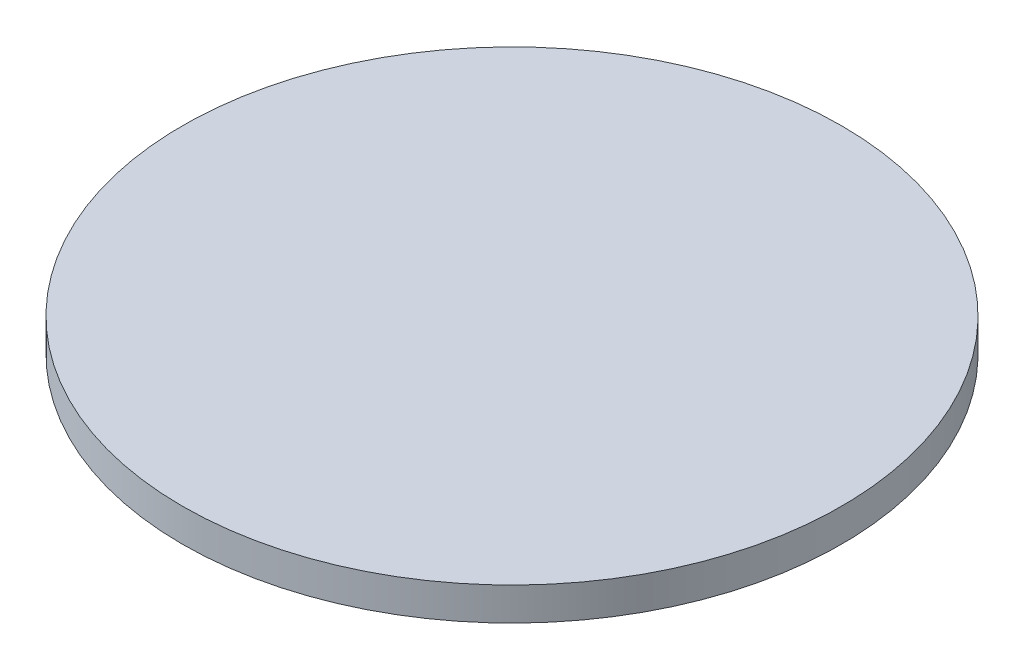
from build123d import *

# Parameters (mm, degrees)
SKETCH_1_R      = 100
EXTRUDE_1_DEPTH = 10


with BuildPart() as part:
    # 草图1 → 凸台-拉伸1 (new body)
    with BuildSketch(Plane(origin=(0, 0, 0), x_dir=(1, 0, 0), z_dir=(0, 1, 0))):
        with Locations(Location((0, 0, 0), (0, 0, 270))):
            Circle(SKETCH_1_R)
    extrude(amount=EXTRUDE_1_DEPTH)


solid = part.part
